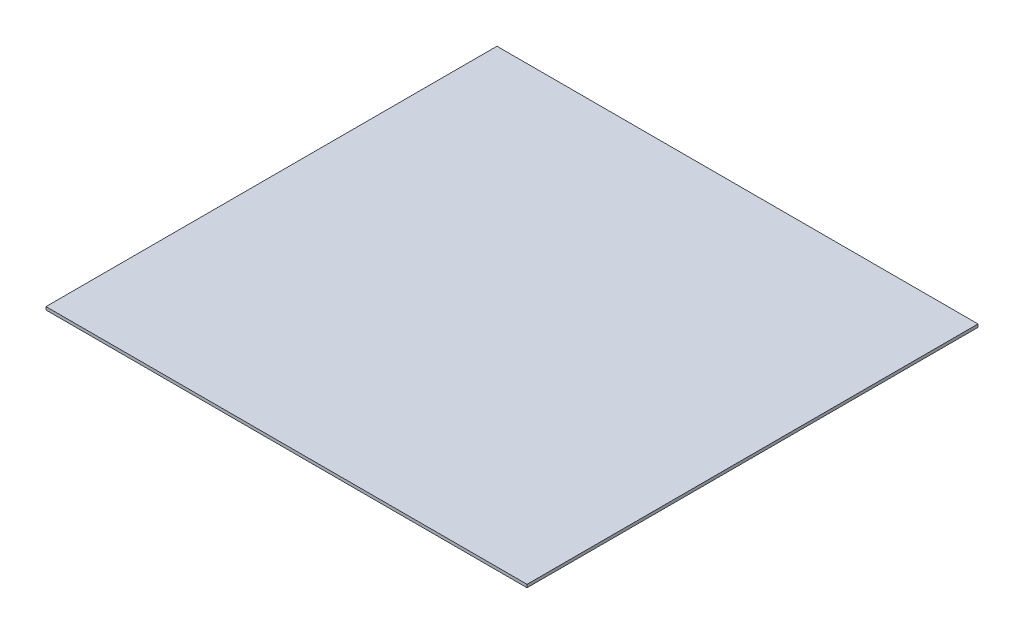
from build123d import *

# Parameters (mm, degrees)
SKETCH1_W           = 812.8
SKETCH1_H           = 762
BOSS_EXTRUDE1_DEPTH = 5.08


with BuildPart() as part:
    # Sketch1 → Boss-Extrude1 (new body)
    with BuildSketch(Plane(origin=(0, 0, 0), x_dir=(1, 0, 0), z_dir=(0, 1, 0))):
        Rectangle(SKETCH1_W, SKETCH1_H)
    extrude(amount=BOSS_EXTRUDE1_DEPTH)


solid = part.part
